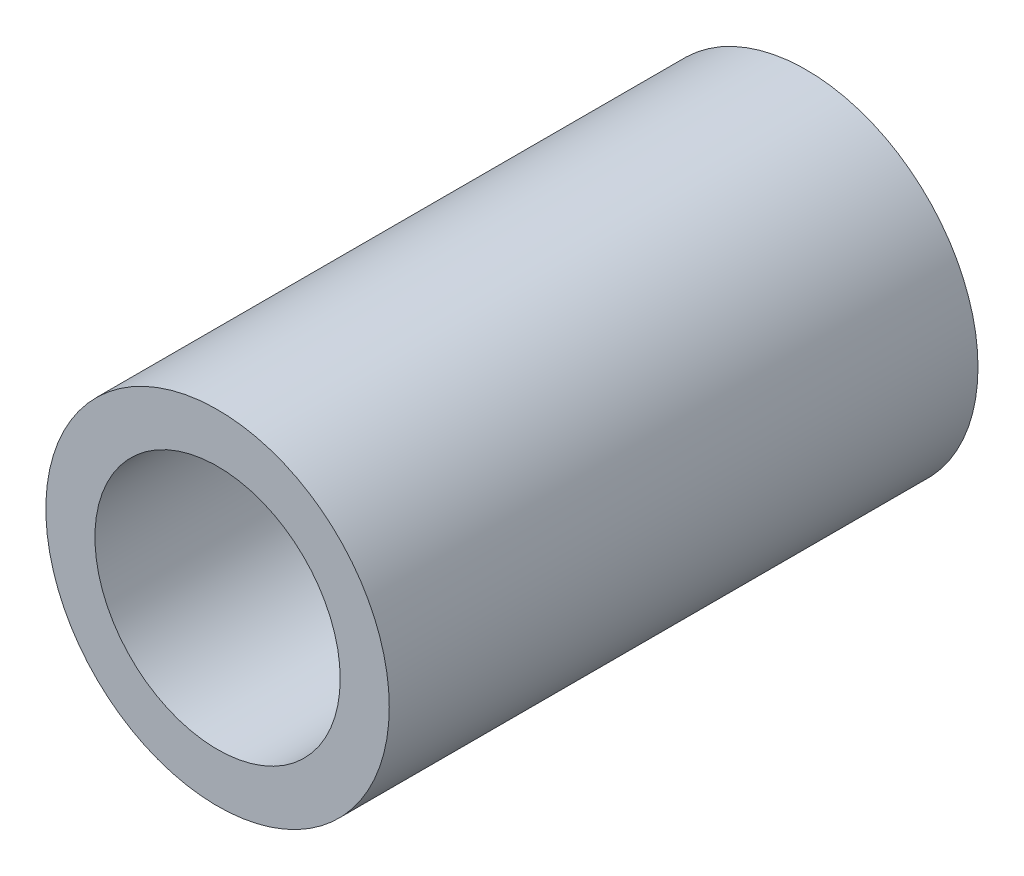
from build123d import *

# Parameters (mm, degrees)
ESBO_O1_R                = 3.5
ESBO_O1_R_2              = 2.5
RESSALTO_EXTRUS_O1_DEPTH = 12


with BuildPart() as part:
    # Esboço1 → Ressalto-extrusão1 (new body)
    with BuildSketch(Plane.XY):
        Circle(ESBO_O1_R)
        Circle(ESBO_O1_R_2, mode=Mode.SUBTRACT)
    extrude(amount=RESSALTO_EXTRUS_O1_DEPTH)


solid = part.part
